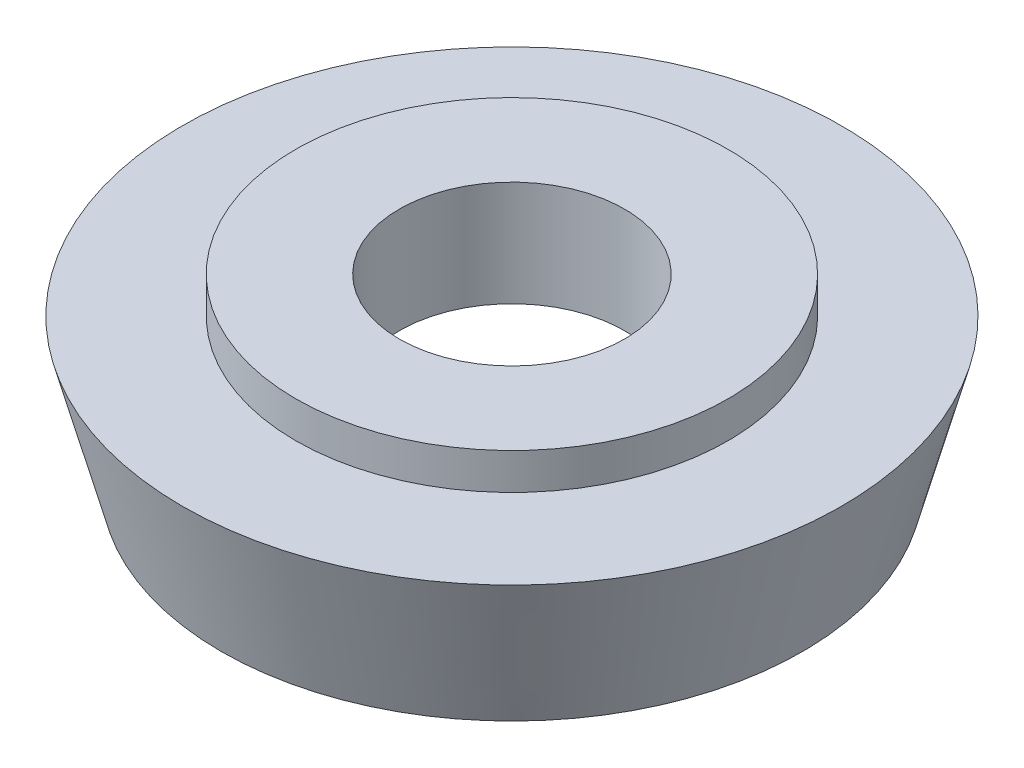
from build123d import *


with BuildPart() as part:
    # Sketch1 → Revolve1 (revolve)
    with BuildSketch(Plane.XY, mode=Mode.PRIVATE) as revolve1_sk:
        Polygon((-1.55, 2.5), (-2.975, 2.5), (-2.975, 2), (-4.535898385, 2), (-4, 0), (-3.05, 0), (-3.05, 1.05), (-1.55, 1.05), align=None)
    revolve(revolve1_sk.sketch.rotate(Axis((0, 2.5, 0), (0, -1, 0)), 270), axis=Axis((0, 2.5, 0), (0, -1, 0)))


solid = part.part
